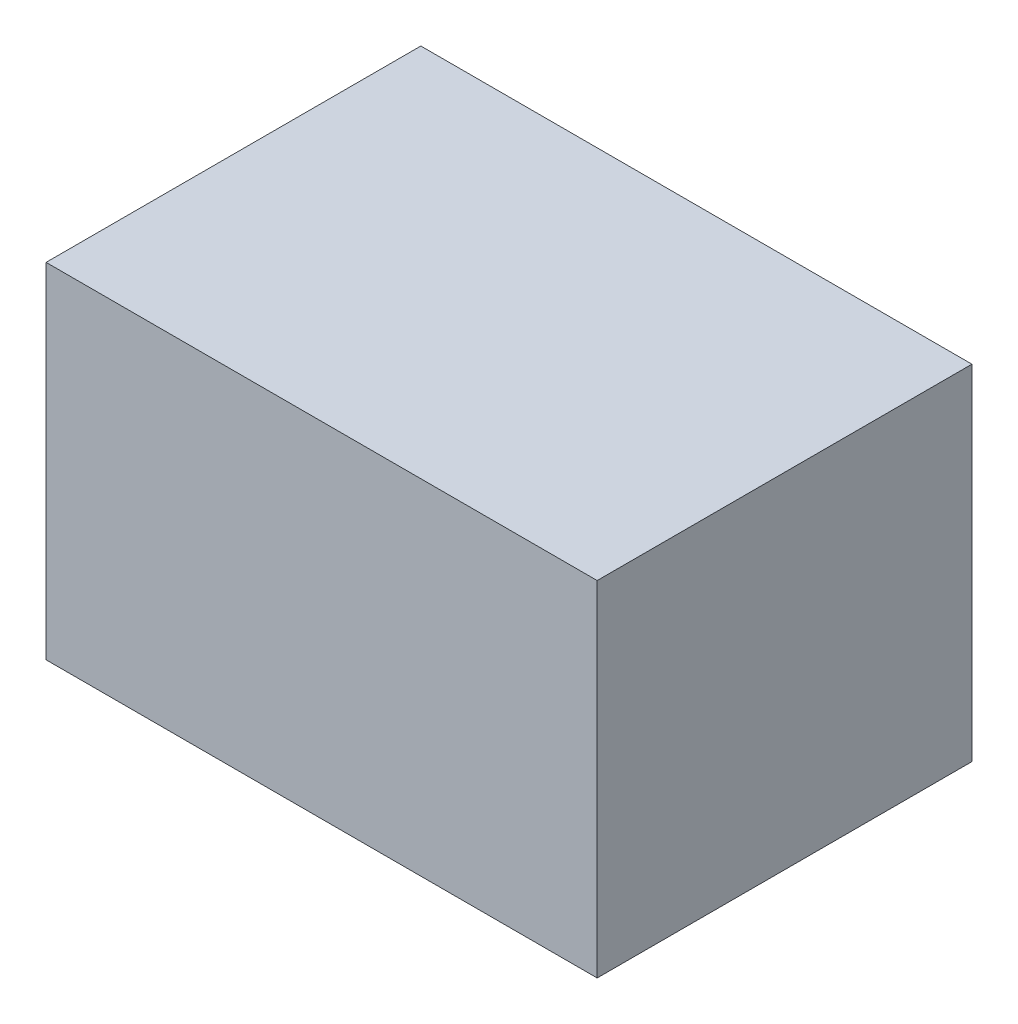
from build123d import *

# Parameters (mm, degrees)
SKETCH1_W           = 825.5
SKETCH1_H           = 515.62
BOSS_EXTRUDE1_DEPTH = 561.34
SKETCH2_W           = 800.1
SKETCH2_H           = 490.22
CUT_EXTRUDE1_DEPTH  = 535.94


with BuildPart() as part:
    # Sketch1 → Boss-Extrude1 (new body)
    with BuildSketch(Plane.XY):
        with Locations((412.75, 257.81)):
            Rectangle(SKETCH1_W, SKETCH1_H)
    extrude(amount=BOSS_EXTRUDE1_DEPTH)

    # Sketch2 → Cut-Extrude1 (cut)
    with BuildSketch(Plane(origin=(0, 0, 0), x_dir=(-1, 0, 0), z_dir=(0, 0, -1))):
        with Locations((-412.75, 257.81)):
            Rectangle(SKETCH2_W, SKETCH2_H)
    extrude(amount=-CUT_EXTRUDE1_DEPTH, mode=Mode.SUBTRACT)


solid = part.part
